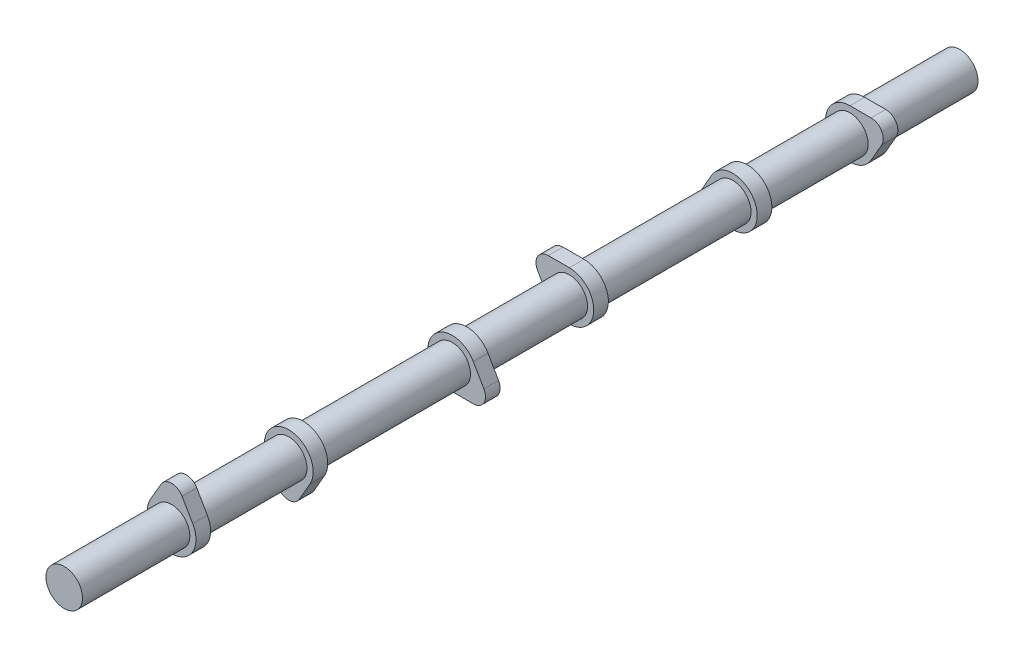
from build123d import *

# Parameters (mm, degrees)
BOSS_EXTRUDE1_DEPTH   = 7.62
LPATTERN3_COUNT       = 2
LPATTERN3_PITCH       = 60.96
BODY_MOVE_COPY4_ANGLE = 180
LPATTERN7_COUNT       = 3
LPATTERN7_PITCH       = 146.05
BODY_MOVE_COPY5_ANGLE = 120
BODY_MOVE_COPY6_ANGLE = 120
BOSS_EXTRUDE2_START   = 55.88
SKETCH4_R             = 9.5
BOSS_EXTRUDE2_DEPTH   = 466.09


with BuildPart() as part:
    # Sketch1 → Boss-Extrude1 (new body)
    with BuildSketch(Plane.XY):
        with BuildLine():
            Line((-10.998522628, 6.35), (-5.499261314, 15.875))
            ThreePointArc((-5.499261314, 15.875), (0, 19.05), (5.499261314, 15.875))
            Line((5.499261314, 15.875), (10.998522628, 6.35))
            ThreePointArc((10.998522628, 6.35), (0, -12.7), (-10.998522628, 6.35))
        make_face()
    extrude(amount=-BOSS_EXTRUDE1_DEPTH)


with BuildPart() as lpattern3_1:
    # LPattern3: pattern copy
    add(part.part.moved(Location(Vector(0, 0, -1) * (1 * LPATTERN3_PITCH))))


with BuildPart() as lpattern3_1_1:
    # Body-Move/Copy4: moved
    add(lpattern3_1.part.rotate(Axis((0, 0, 0), (0, 0, 1)), BODY_MOVE_COPY4_ANGLE))


with BuildPart() as lpattern7_1:
    # LPattern7: pattern copy
    add(lpattern3_1_1.part.moved(Location(Vector(0, 0, -1) * (1 * LPATTERN7_PITCH))))


with BuildPart() as lpattern7_2:
    # LPattern7: pattern copy
    add(lpattern3_1_1.part.moved(Location(Vector(0, 0, -1) * (2 * LPATTERN7_PITCH))))


with BuildPart() as lpattern7_3:
    # LPattern7: pattern copy
    add(part.part.moved(Location(Vector(0, 0, -1) * (1 * LPATTERN7_PITCH))))


with BuildPart() as lpattern7_4:
    # LPattern7: pattern copy
    add(part.part.moved(Location(Vector(0, 0, -1) * (2 * LPATTERN7_PITCH))))


with BuildPart() as lpattern7_3_1:
    # Body-Move/Copy5: moved
    add(lpattern7_3.part.rotate(Axis((0, 0, 0), (0, 0, -1)), BODY_MOVE_COPY5_ANGLE))


with BuildPart() as lpattern7_1_1:
    # Body-Move/Copy5: moved
    add(lpattern7_1.part.rotate(Axis((0, 0, 0), (0, 0, -1)), BODY_MOVE_COPY5_ANGLE))


with BuildPart() as lpattern7_4_1:
    # Body-Move/Copy6: moved
    add(lpattern7_4.part.rotate(Axis((0, 0, 0), (0, 0, 1)), BODY_MOVE_COPY6_ANGLE))


with BuildPart() as lpattern7_2_1:
    # Body-Move/Copy6: moved
    add(lpattern7_2.part.rotate(Axis((0, 0, 0), (0, 0, 1)), BODY_MOVE_COPY6_ANGLE))


with BuildPart() as part_1:
    add(part.part)

    add(lpattern3_1_1.part)  # Boss-Extrude2 merges LPattern3_1

    add(lpattern7_1_1.part)  # Boss-Extrude2 merges LPattern7_1

    add(lpattern7_2_1.part)  # Boss-Extrude2 merges LPattern7_2

    add(lpattern7_3_1.part)  # Boss-Extrude2 merges LPattern7_3

    add(lpattern7_4_1.part)  # Boss-Extrude2 merges LPattern7_4
    # Sketch4 → Boss-Extrude2 (add)
    with BuildSketch(Plane.XY.offset(BOSS_EXTRUDE2_START)):
        Circle(SKETCH4_R)
    extrude(amount=-BOSS_EXTRUDE2_DEPTH)


solid = part_1.part
